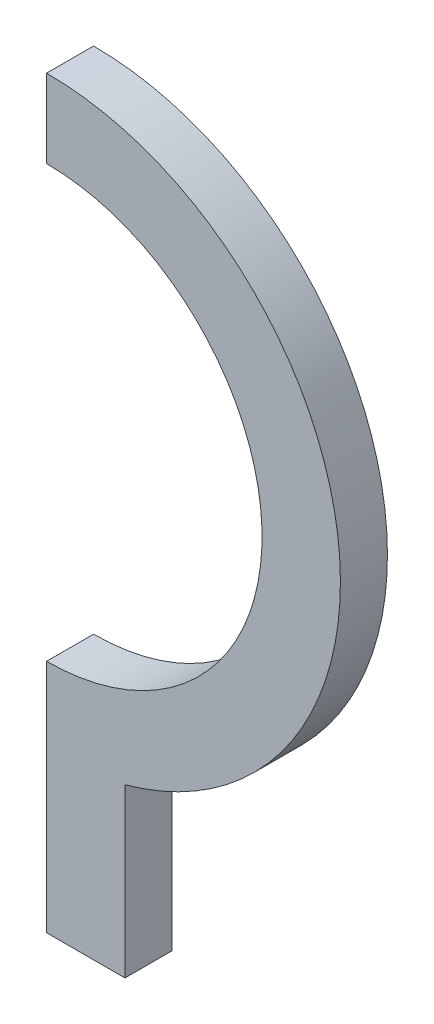
from build123d import *

# Parameters (mm, degrees)
BOSS_EXTRUDE1_DEPTH = 6


with BuildPart() as part:
    # Sketch1 → Boss-Extrude1 (new body)
    with BuildSketch(Plane(origin=(0, 0, 0), x_dir=(0, 1, 0), z_dir=(0, 0, 1))):
        with BuildLine():
            Line((10, 5), (20, 5))
            ThreePointArc((20, 5), (47.5, -22.5), (75, 5))
            Line((75, 5), (85, 5))
            ThreePointArc((85, 5), (52.545888047, -32.158969493), (11.357919263, -5))
            Line((11.357919263, -5), (10, -5))
            Line((10, -5), (-10, -5))
            Line((-10, -5), (-10, 5))
            Line((-10, 5), (10, 5))
        make_face()
    extrude(amount=BOSS_EXTRUDE1_DEPTH)


solid = part.part
